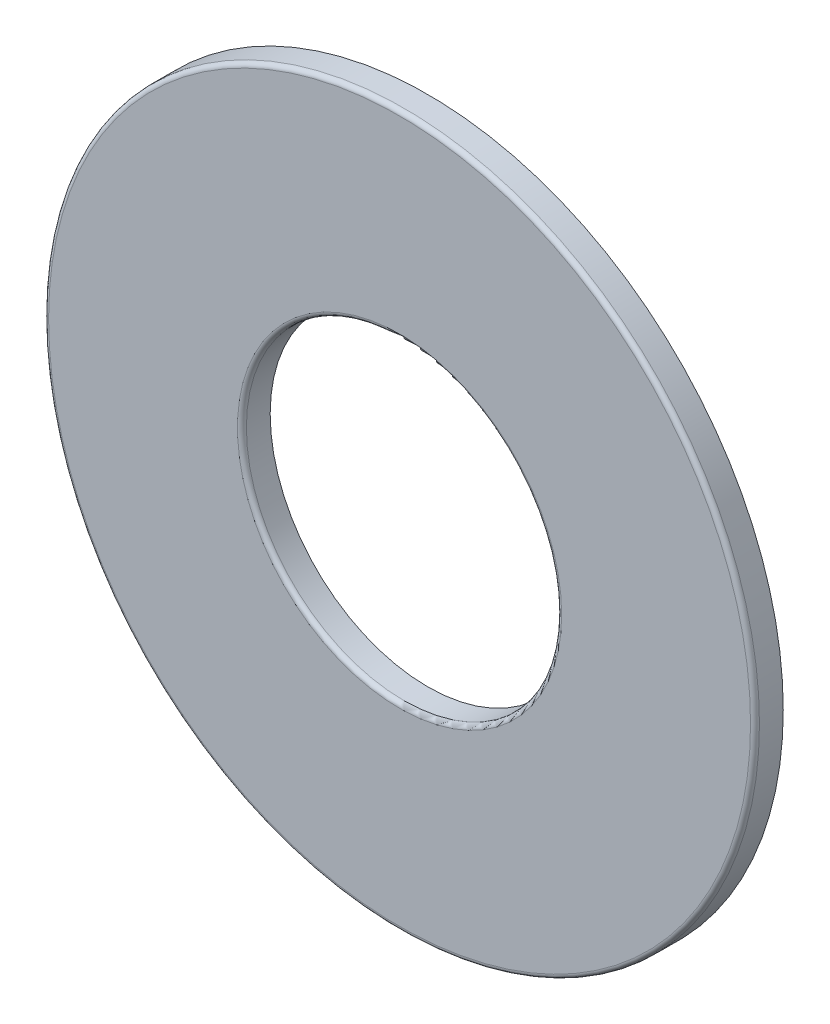
from build123d import *


with BuildPart() as part:
    # Sketch1 → Revolve1 (revolve)
    with BuildSketch(Plane(origin=(0, 0, 0), x_dir=(1, 0, 0), z_dir=(0, 1, 0)), mode=Mode.PRIVATE) as revolve1_sk:
        with BuildLine():
            Line((-47.5, 1.5), (-47.5, 0.8))
            ThreePointArc((-47.5, 0.8), (-47.412132034, 0.587867966), (-47.2, 0.5))
            Line((-47.2, 0.5), (-46.5, 0.5))
            Line((-46.5, 0.5), (-22.5, 0.5))
            Line((-22.5, 0.5), (-21.8, 0.5))
            ThreePointArc((-21.8, 0.5), (-21.587867966, 0.587867966), (-21.5, 0.8))
            Line((-21.5, 0.8), (-21.5, 1.5))
            Line((-21.5, 1.5), (-21.5, 4))
            Line((-21.5, 4), (-21.2, 4))
            Line((-21.2, 4), (-21.2, 0.8))
            ThreePointArc((-21.2, 0.8), (-21.375735931, 0.375735931), (-21.8, 0.2))
            Line((-21.8, 0.2), (-47.2, 0.2))
            ThreePointArc((-47.2, 0.2), (-47.624264069, 0.375735931), (-47.8, 0.8))
            Line((-47.8, 0.8), (-47.8, 4))
            Line((-47.8, 4), (-47.5, 4))
            Line((-47.5, 4), (-47.5, 1.5))
        make_face()
    revolve(revolve1_sk.sketch.rotate(Axis((0, 0, 0), (0, 0, -1)), 180), axis=Axis((0, 0, 0), (0, 0, -1)))


solid = part.part
